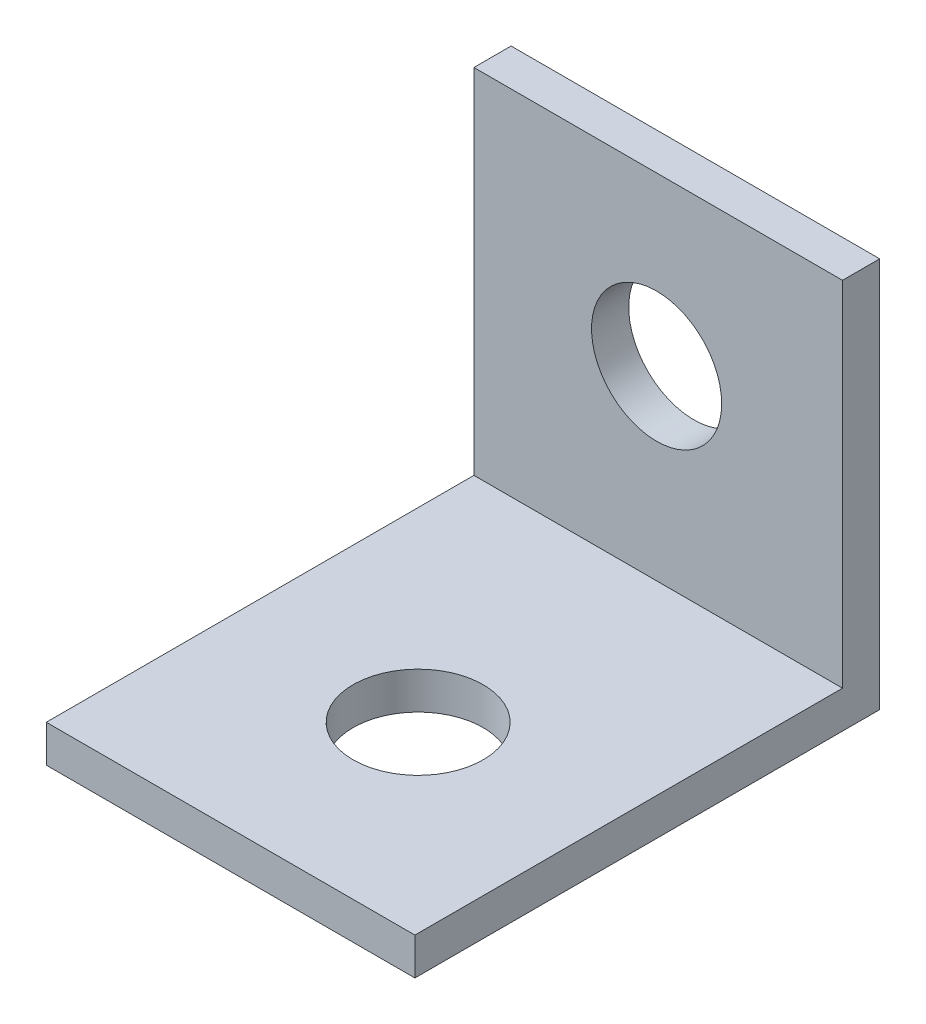
from build123d import *

# Parameters (mm, degrees)
SKETCH1_W           = 9.91326949
SKETCH1_H           = 11.5
SKETCH1_R           = 1.75
BOSS_EXTRUDE3_DEPTH = 1
SKETCH1_5_W         = 9.91326949
SKETCH1_5_H         = 1
BOSS_EXTRUDE4_DEPTH = 10.5
SKETCH2_R           = 1.75
CUT_EXTRUDE1_DEPTH  = 1


with BuildPart() as part:
    # Sketch1 → Boss-Extrude3 (new body)
    with BuildSketch(Plane(origin=(0, 0, 0), x_dir=(1, 0, 0), z_dir=(0, 1, 0))):
        with Locations((4.956634745, 5.75)):
            Rectangle(SKETCH1_W, SKETCH1_H)
        with Locations((5, 5)):
            Circle(SKETCH1_R, mode=Mode.SUBTRACT)
    extrude(amount=BOSS_EXTRUDE3_DEPTH)

    # Sketch1<5> → Boss-Extrude4 (add)
    with BuildSketch(Plane(origin=(0, 0, 0), x_dir=(1, 0, 0), z_dir=(0, 1, 0))):
        with Locations((4.956634745, 12)):
            Rectangle(SKETCH1_5_W, SKETCH1_5_H)
    extrude(amount=BOSS_EXTRUDE4_DEPTH)

    # Sketch2 → Cut-Extrude1 (cut)
    with BuildSketch(Plane.XY.offset(-11.5)):
        with Locations((4.91326949, 6)):
            Circle(SKETCH2_R)
    extrude(amount=-CUT_EXTRUDE1_DEPTH, mode=Mode.SUBTRACT)


solid = part.part
